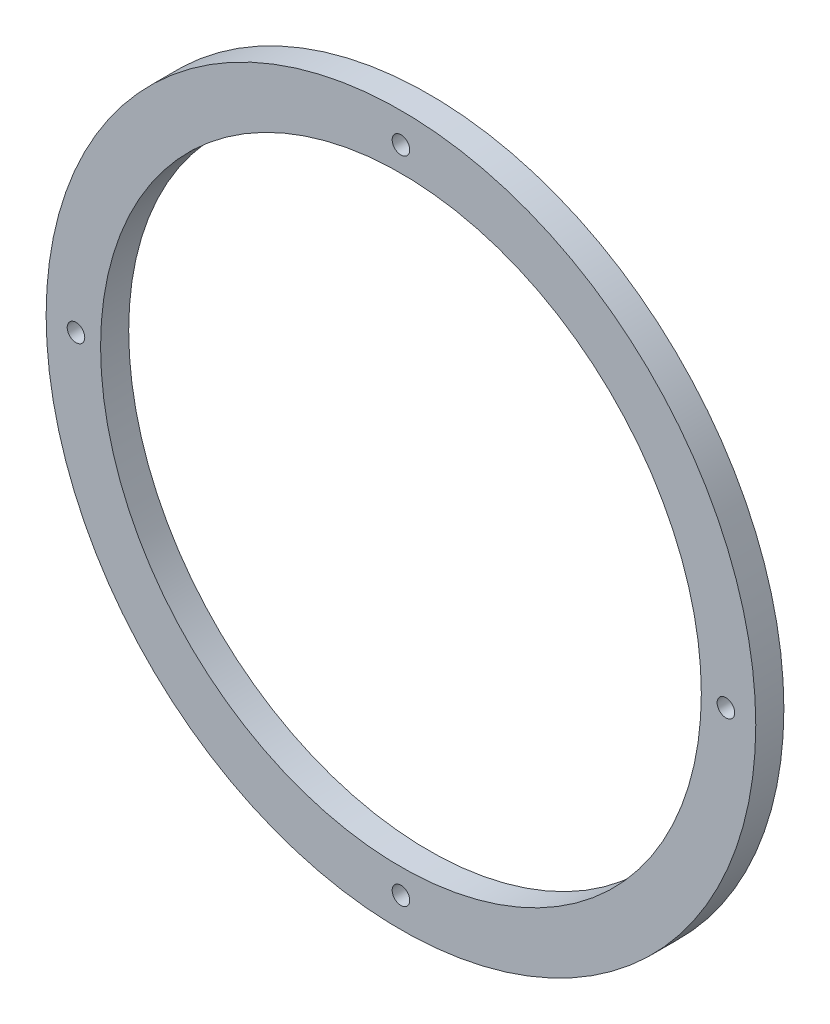
from build123d import *

# Parameters (mm, degrees)
SKETCH1_R           = 101
SKETCH1_R_2         = 85.5
BOSS_EXTRUDE1_DEPTH = 8
SKETCH2_R           = 2.5
CUT_EXTRUDE1_DEPTH  = 144.059428211


with BuildPart() as part:
    # Sketch1 → Boss-Extrude1 (new body)
    with BuildSketch(Plane.XY):
        Circle(SKETCH1_R)
        Circle(SKETCH1_R_2, mode=Mode.SUBTRACT)
    extrude(amount=BOSS_EXTRUDE1_DEPTH)

    # Sketch2 → Cut-Extrude1 (cut, through all)
    with BuildSketch(Plane.XY.offset(8)):
        with Locations((0, 92.5)):
            Circle(SKETCH2_R)
        with Locations((92.5, 0)):
            Circle(SKETCH2_R)
        with Locations((0, -92.5)):
            Circle(SKETCH2_R)
        with Locations((-92.5, 0)):
            Circle(SKETCH2_R)
    extrude(amount=-CUT_EXTRUDE1_DEPTH, mode=Mode.SUBTRACT)


solid = part.part
